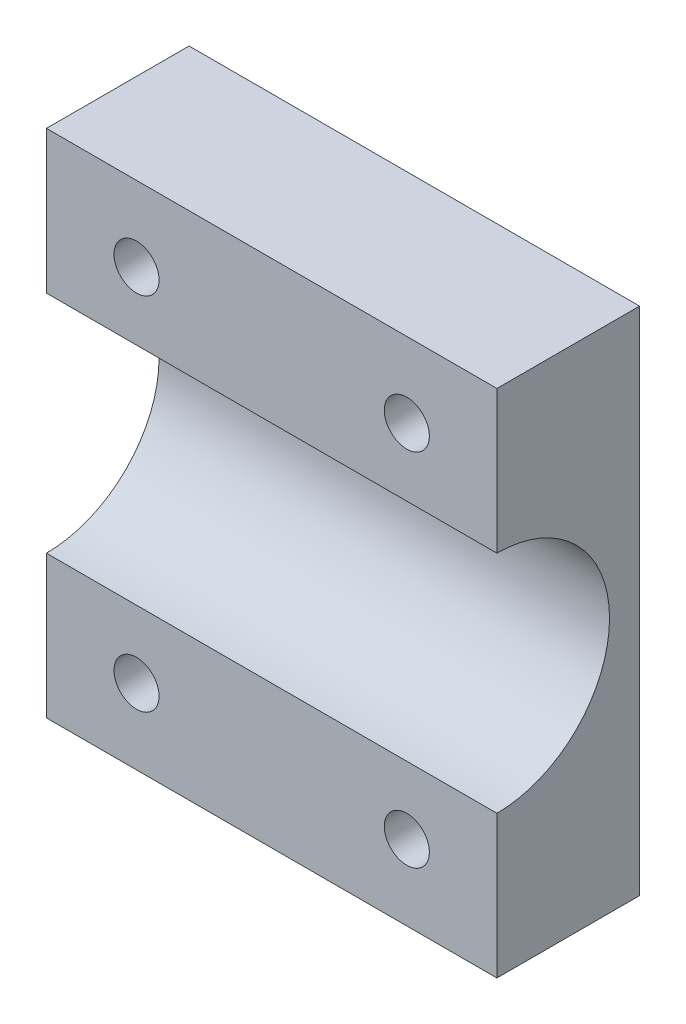
from build123d import *

# Parameters (mm, degrees)
SKETCH_1_W          = 30
SKETCH_1_H          = 34
SKETCH_1_R          = 1.5
EXTRUDE_2_DEPTH     = 9.5
SKETCH_3_R          = 7.5
CUT_EXTRUDE_1_DEPTH = 40


with BuildPart() as part:
    # 草图1 → 凸台-拉伸2 (new body)
    with BuildSketch(Plane.XY):
        with Locations((-7.961038961, 0)):
            Rectangle(SKETCH_1_W, SKETCH_1_H)
        with Locations((1.038961039, 12)):
            Circle(SKETCH_1_R, mode=Mode.SUBTRACT)
        with Locations((-16.961038961, 12)):
            Circle(SKETCH_1_R, mode=Mode.SUBTRACT)
        with Locations((1.038961039, -12)):
            Circle(SKETCH_1_R, mode=Mode.SUBTRACT)
        with Locations((-16.961038961, -12)):
            Circle(SKETCH_1_R, mode=Mode.SUBTRACT)
    extrude(amount=EXTRUDE_2_DEPTH)

    # 草图3 → 切除-拉伸1 (cut)
    with BuildSketch(Plane.ZY.offset(22.961038961)):
        with Locations((9.5, 0)):
            Circle(SKETCH_3_R)
    extrude(amount=-CUT_EXTRUDE_1_DEPTH, mode=Mode.SUBTRACT)


solid = part.part
